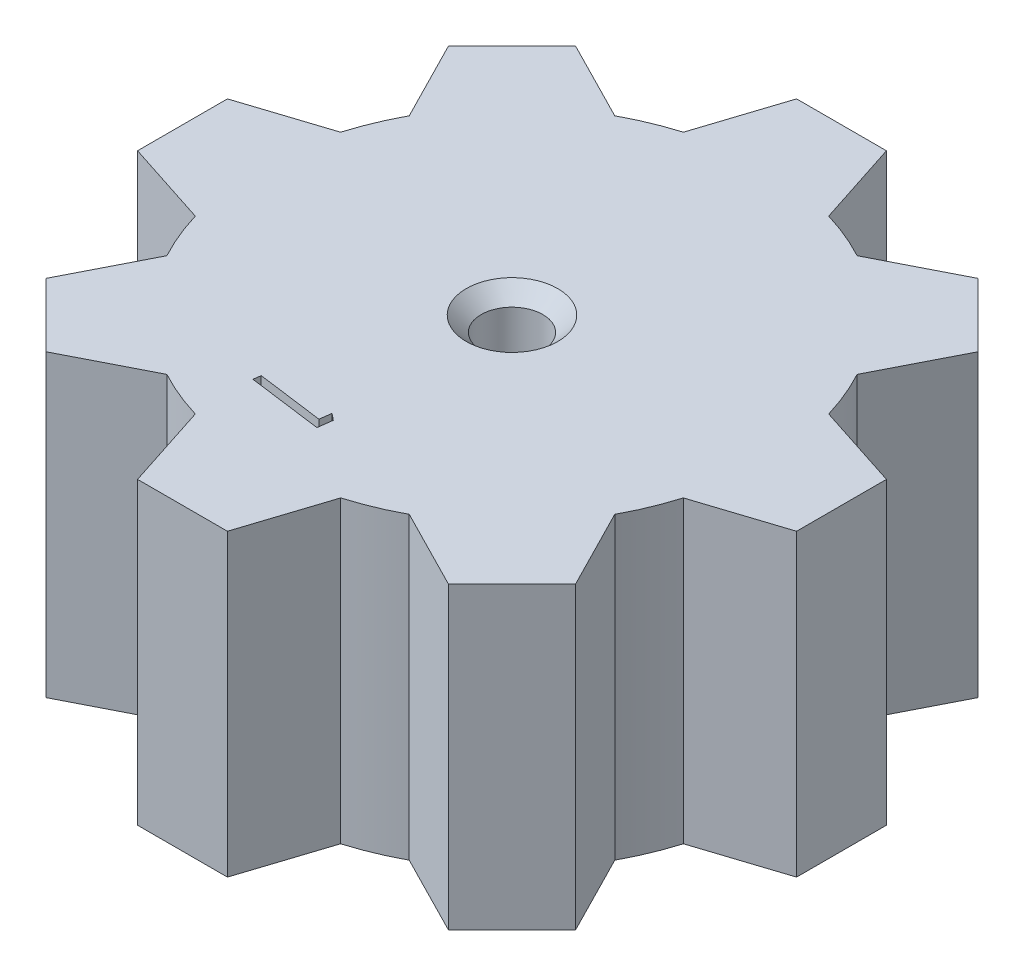
from build123d import *

# Parameters (mm, degrees)
SKETCH1_R           = 1.03
BOSS_EXTRUDE1_DEPTH = 10
CUT_EXTRUDE1_DEPTH  = 1
CHAMFER1_SIZE       = 0.5


with BuildPart() as part:
    # Sketch1 → Boss-Extrude1 (new body)
    with BuildSketch(Plane(origin=(0, 0, 0), x_dir=(1, 0, 0), z_dir=(0, 1, 0))):
        with BuildLine():
            Line((-1.5, 11), (1.5, 11))
            Line((1.5, 11), (2.425924848, 8.146464793))
            ThreePointArc((2.425924848, 8.146464793), (3.252809175, 7.852976026), (4.045032587, 7.475808409))
            Line((4.045032587, 7.475808409), (6.717514421, 8.838834765))
            Line((6.717514421, 8.838834765), (8.838834765, 6.717514421))
            Line((8.838834765, 6.717514421), (7.475808409, 4.045032587))
            ThreePointArc((7.475808409, 4.045032587), (7.852976026, 3.252809175), (8.146464793, 2.425924848))
            Line((8.146464793, 2.425924848), (11, 1.5))
            Line((11, 1.5), (11, -1.5))
            Line((11, -1.5), (8.146464793, -2.425924848))
            ThreePointArc((8.146464793, -2.425924848), (7.852976026, -3.252809175), (7.475808409, -4.045032587))
            Line((7.475808409, -4.045032587), (8.838834765, -6.717514421))
            Line((8.838834765, -6.717514421), (6.717514421, -8.838834765))
            Line((6.717514421, -8.838834765), (4.045032587, -7.475808409))
            ThreePointArc((4.045032587, -7.475808409), (3.252809175, -7.852976026), (2.425924848, -8.146464793))
            Line((2.425924848, -8.146464793), (1.5, -11))
            Line((1.5, -11), (-1.5, -11))
            Line((-1.5, -11), (-2.425924848, -8.146464793))
            ThreePointArc((-2.425924848, -8.146464793), (-3.252809175, -7.852976026), (-4.045032587, -7.475808409))
            Line((-4.045032587, -7.475808409), (-6.717514421, -8.838834765))
            Line((-6.717514421, -8.838834765), (-8.838834765, -6.717514421))
            Line((-8.838834765, -6.717514421), (-7.475808409, -4.045032587))
            ThreePointArc((-7.475808409, -4.045032587), (-7.852976026, -3.252809175), (-8.146464793, -2.425924848))
            Line((-8.146464793, -2.425924848), (-11, -1.5))
            Line((-11, -1.5), (-11, 1.5))
            Line((-11, 1.5), (-8.146464793, 2.425924848))
            ThreePointArc((-8.146464793, 2.425924848), (-7.852976026, 3.252809175), (-7.475808409, 4.045032587))
            Line((-7.475808409, 4.045032587), (-8.838834765, 6.717514421))
            Line((-8.838834765, 6.717514421), (-6.717514421, 8.838834765))
            Line((-6.717514421, 8.838834765), (-4.045032587, 7.475808409))
            ThreePointArc((-4.045032587, 7.475808409), (-3.252809175, 7.852976026), (-2.425924848, 8.146464793))
            Line((-2.425924848, 8.146464793), (-1.5, 11))
        make_face()
        with Locations(Location((0, 0, 0), (0, 0, 270))):
            Circle(SKETCH1_R, mode=Mode.SUBTRACT)
    extrude(amount=BOSS_EXTRUDE1_DEPTH)

    # Sketch2 → Cut-Extrude1 (cut)
    with BuildSketch(Plane(origin=(0, 10, 0), x_dir=(1, 0, 0), z_dir=(0, 1, 0))):
        Polygon((0.061172217, -6.025718493), (-0.003431149, -6.509993333), (-2.466872655, -6.181467692), (-2.434320572, -5.936575865), (-0.212265283, -6.233050224), (-0.160682751, -5.846431634), align=None)
    extrude(amount=-CUT_EXTRUDE1_DEPTH, mode=Mode.SUBTRACT)

    # Chamfer1
    chamfer1_edges = [part.edges().sort_by_distance(p)[0] for p in [
        (0, 10, -1.03),
    ]]
    chamfer(chamfer1_edges, length=CHAMFER1_SIZE)


solid = part.part
